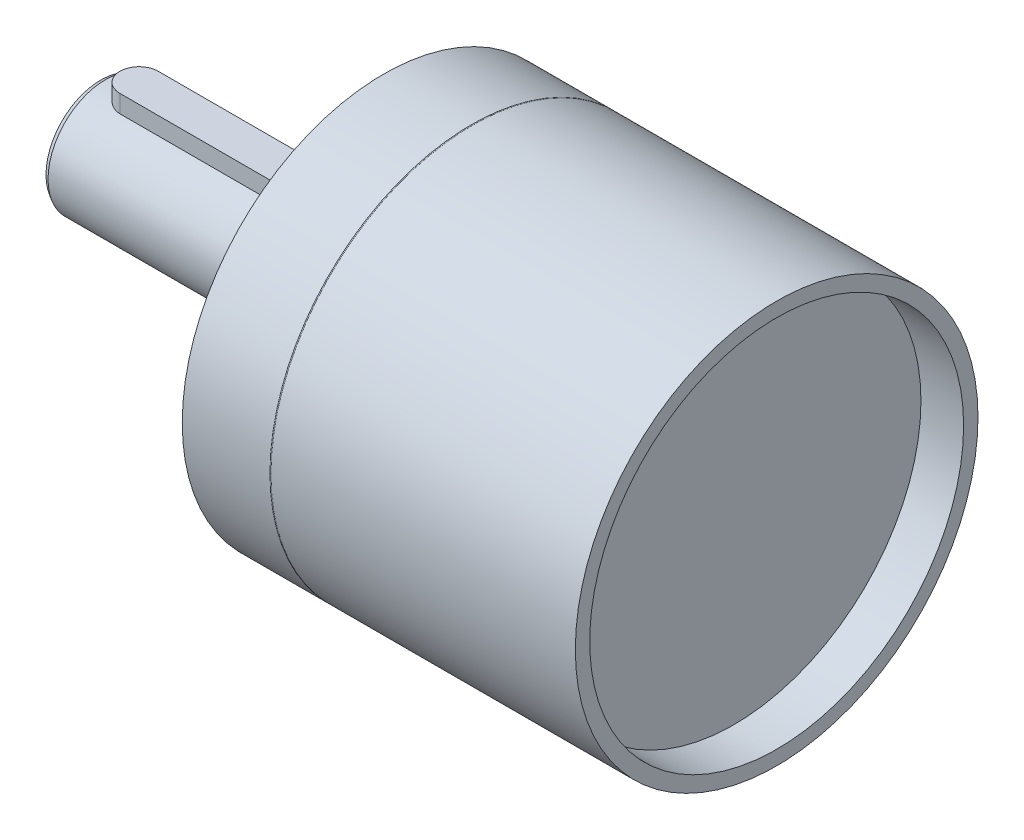
from build123d import *

# Parameters (mm, degrees)
SKETCH2_R                              = 14
BOSS_EXTRUDE1_DEPTH                    = 3
SKETCH3_R                              = 6
BOSS_EXTRUDE2_DEPTH                    = 26.5
BOSS_EXTRUDE4_REACH                    = 56.169
BOSS_EXTRUDE4_END_RADIUS               = 6
M36_CLEARANCE_HOLE1_D                  = 39
M36_CLEARANCE_HOLE1_DEPTH              = 4.45
F_1_5_1_5_DIAMETER_HOLE1_D             = 1.5
F_1_5_1_5_DIAMETER_HOLE1_DEPTH         = 2
F_1_5_1_5_DIAMETER_HOLE1_TIP           = 0.450645464
F_3_3_3_3_DIAMETER_HOLE1_D             = 3.3
F_3_3_3_3_DIAMETER_HOLE1_DEPTH         = 6
F_3_3_3_3_DIAMETER_HOLE1_TIP           = 0.991420021
F_1_25_1_25_DIAMETER_HOLE1_D           = 1.25
F_1_25_1_25_DIAMETER_HOLE1_DEPTH       = 1.939156082
F_1_25_1_25_DIAMETER_HOLE1_CSINK_D     = 2.65
F_1_25_1_25_DIAMETER_HOLE1_CSINK_ANGLE = 60
F_1_25_1_25_DIAMETER_HOLE1_TIP         = 0.360843918
CHAMFER1_SIZE                          = 0.288675135
CHAMFER1_SIZE2                         = 0.5


with BuildPart() as part:
    # Sketch1 → Revolve1 (revolve)
    with BuildSketch(Plane.XY, mode=Mode.PRIVATE) as revolve1_sk:
        with BuildLine():
            Line((0, 21), (0, 0))
            Line((0, 0), (41, 0))
            Line((41, 0), (41, 21))
            Line((41, 21), (9.25, 21))
            ThreePointArc((9.25, 21), (9.2, 20.98660254), (9.15, 21))
            Line((9.15, 21), (0, 21))
        make_face()
    revolve(revolve1_sk.sketch.rotate(Axis((0, 0, 0), (1, 0, 0)), 270), axis=Axis((0, 0, 0), (1, 0, 0)))

    # Sketch2 → Boss-Extrude1 (add)
    with BuildSketch(Plane.ZY):
        Circle(SKETCH2_R)
    extrude(amount=BOSS_EXTRUDE1_DEPTH)

    # Sketch3 → Boss-Extrude2 (add)
    with BuildSketch(Plane.ZY.offset(3)):
        Circle(SKETCH3_R)
    extrude(amount=BOSS_EXTRUDE2_DEPTH)

    # Boss-Extrude4: up to this cylinder (the profile starts outside it)
    boss_extrude4_end = Plane(origin=(-17.5, 0, 0), z_dir=(1, 0, 0)) * Cylinder(BOSS_EXTRUDE4_END_RADIUS, 125.338, mode=Mode.PRIVATE)
    # Sketch5 → Boss-Extrude4 (add, up to the surface)
    with BuildSketch(Plane(origin=(0, 7.5, 0), x_dir=(1, 0, 0), z_dir=(0, 1, 0)), mode=Mode.PRIVATE) as boss_extrude4_sk1:
        with BuildLine():
            Line((-9.5, 2), (-25.5, 2))
            ThreePointArc((-25.5, 2), (-27.5, 0), (-25.5, -2))
            Line((-25.5, -2), (-9.5, -2))
            ThreePointArc((-9.5, -2), (-7.5, 0), (-9.5, 2))
        make_face()
    boss_extrude4_tool1 = extrude(boss_extrude4_sk1.sketch, amount=-BOSS_EXTRUDE4_REACH, mode=Mode.PRIVATE) - boss_extrude4_end
    add(boss_extrude4_tool1.solids().sort_by_distance((-17.5, 7.5, 0))[0])

    # M36 Clearance Hole1
    with Locations(Plane(origin=(41, 0, 0), x_dir=(0, 0, -1), z_dir=(1, 0, 0))):
        with Locations((0, 0)):
            Hole(M36_CLEARANCE_HOLE1_D / 2, depth=M36_CLEARANCE_HOLE1_DEPTH)

    # Ø1.5 (1.5) Diameter Hole1
    with Locations(Plane.ZY):
        with Locations((-7.462326931, 18.015650884)):
            Hole(F_1_5_1_5_DIAMETER_HOLE1_D / 2, depth=F_1_5_1_5_DIAMETER_HOLE1_DEPTH)
            with Locations((0, 0, -(F_1_5_1_5_DIAMETER_HOLE1_DEPTH + F_1_5_1_5_DIAMETER_HOLE1_TIP / 2))):  # 118° drill point
                Cone(0, F_1_5_1_5_DIAMETER_HOLE1_D / 2, F_1_5_1_5_DIAMETER_HOLE1_TIP, mode=Mode.SUBTRACT)

    # Ø3.3 (3.3) Diameter Hole1
    with Locations(Plane.ZY):
        with Locations((3.0543e-05, 17.5), (17.5, -3.0543e-05), (-3.0543e-05, -17.5), (-17.5, 3.0543e-05)):
            Hole(F_3_3_3_3_DIAMETER_HOLE1_D / 2, depth=F_3_3_3_3_DIAMETER_HOLE1_DEPTH)
            with Locations((0, 0, -(F_3_3_3_3_DIAMETER_HOLE1_DEPTH + F_3_3_3_3_DIAMETER_HOLE1_TIP / 2))):  # 118° drill point
                Cone(0, F_3_3_3_3_DIAMETER_HOLE1_D / 2, F_3_3_3_3_DIAMETER_HOLE1_TIP, mode=Mode.SUBTRACT)

    # Ø1.25 (1.25) Diameter Hole1
    with Locations(Plane.ZY.offset(29.5)):
        with Locations((0, 0)):
            CounterSinkHole(F_1_25_1_25_DIAMETER_HOLE1_D / 2, F_1_25_1_25_DIAMETER_HOLE1_CSINK_D / 2, depth=F_1_25_1_25_DIAMETER_HOLE1_DEPTH, counter_sink_angle=F_1_25_1_25_DIAMETER_HOLE1_CSINK_ANGLE)
            with Locations((0, 0, -(F_1_25_1_25_DIAMETER_HOLE1_DEPTH + F_1_25_1_25_DIAMETER_HOLE1_TIP / 2))):  # 120° drill point
                Cone(0, F_1_25_1_25_DIAMETER_HOLE1_D / 2, F_1_25_1_25_DIAMETER_HOLE1_TIP, mode=Mode.SUBTRACT)

    # Chamfer1
    chamfer1_edges = [part.edges().sort_by_distance(p)[0] for p in [
        (-29.5, 0, -6),
    ]]
    chamfer1_side = [part.faces().sort_by_distance(p)[0] for p in [
        (-29.5, 0, -5.830294373),
    ]]
    chamfer(chamfer1_edges, length=CHAMFER1_SIZE, length2=CHAMFER1_SIZE2, reference=chamfer1_side[0])


solid = part.part
